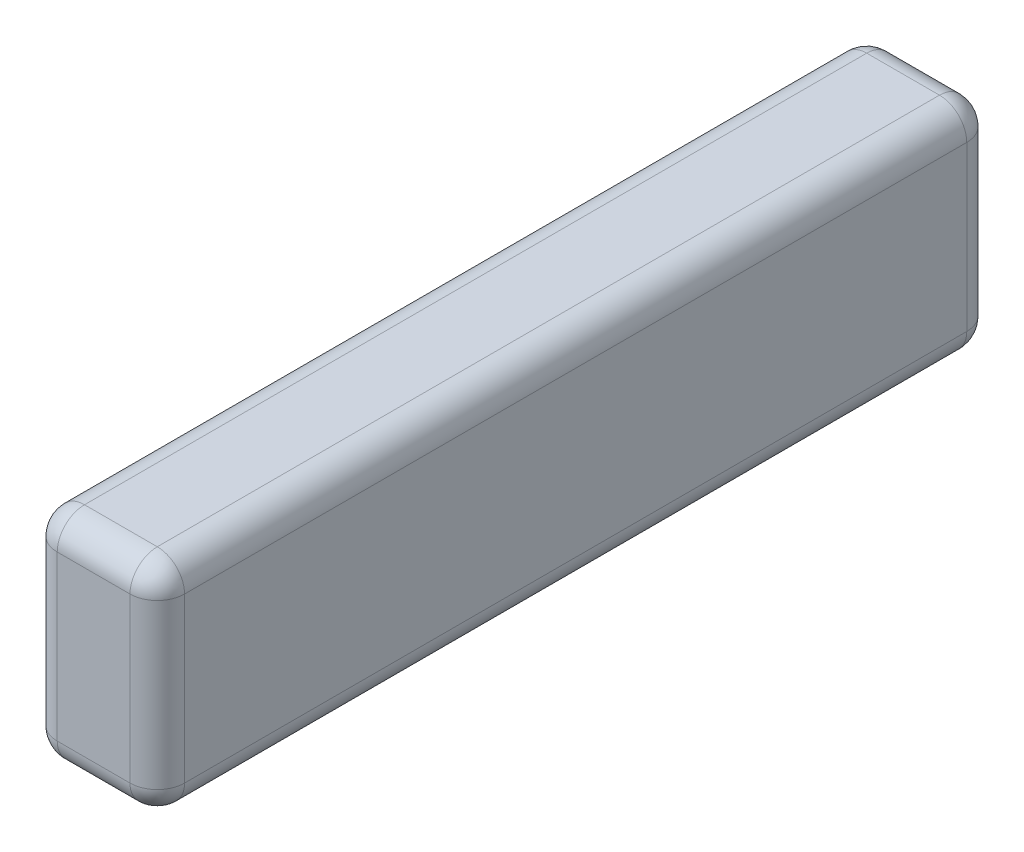
from build123d import *

# Parameters (mm, degrees)
ESBO_O1_W                = 7
ESBO_O1_H                = 46
RESSALTO_EXTRUS_O1_DEPTH = 12
FILETE1_R                = 1.5


with BuildPart() as part:
    # Esboço1 → Ressalto-extrusão1 (new body)
    with BuildSketch(Plane(origin=(0, 0, 0), x_dir=(1, 0, 0), z_dir=(0, 1, 0))):
        with Locations((14.166666667, 0.820652174)):
            Rectangle(ESBO_O1_W, ESBO_O1_H)
    extrude(amount=RESSALTO_EXTRUS_O1_DEPTH)

    # Filete1
    filete1_edges = [part.edges().sort_by_distance(p)[0] for p in [
        (17.666666667, 12, -0.820652174),
        (14.166666667, 12, -23.820652174),
        (10.666666667, 12, -0.820652174),
        (14.166666667, 0, -23.820652174),
        (17.666666667, 0, -0.820652174),
        (14.166666667, 0, 22.179347826),
        (10.666666667, 0, -0.820652174),
        (10.666666667, 6, -23.820652174),
        (17.666666667, 6, -23.820652174),
        (17.666666667, 6, 22.179347826),
        (10.666666667, 6, 22.179347826),
        (14.166666667, 12, 22.179347826),
    ]]
    fillet(filete1_edges, radius=FILETE1_R)


solid = part.part
